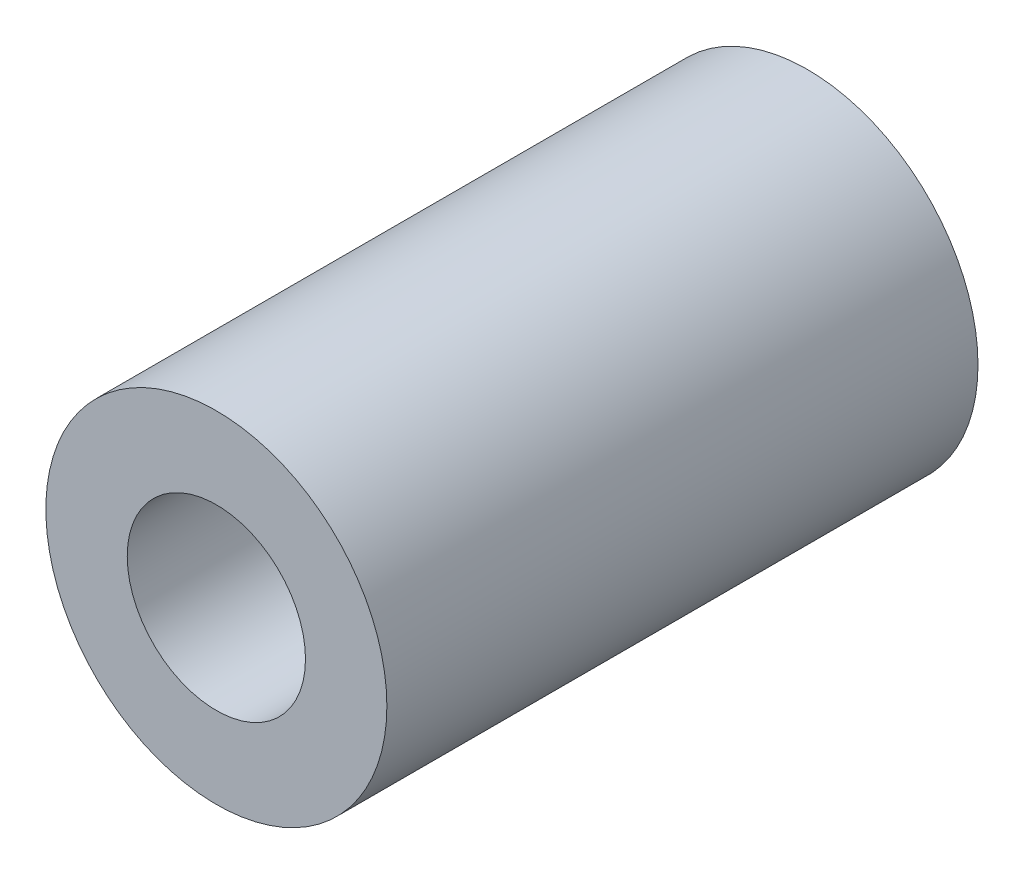
from build123d import *

# Parameters (mm, degrees)
SKETCH1_R           = 4.7625
SKETCH1_R_2         = 2.4892
BOSS_EXTRUDE1_DEPTH = 16.51


with BuildPart() as part:
    # Sketch1 → Boss-Extrude1 (new body)
    with BuildSketch(Plane.XY):
        Circle(SKETCH1_R)
        Circle(SKETCH1_R_2, mode=Mode.SUBTRACT)
    extrude(amount=BOSS_EXTRUDE1_DEPTH)


solid = part.part
